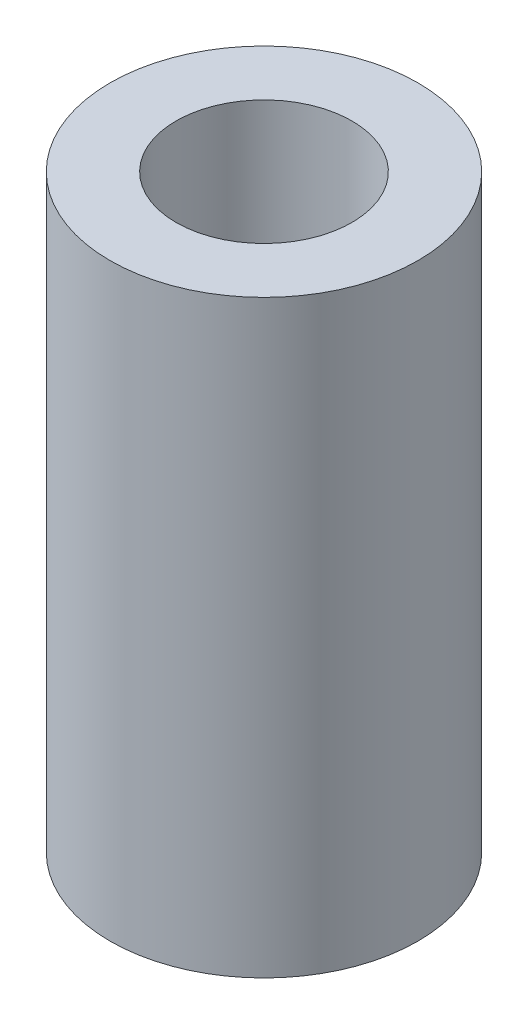
from build123d import *

# Parameters (mm, degrees)
SKETCH1_R           = 1.75
SKETCH1_R_2         = 1
BOSS_EXTRUDE1_DEPTH = 6.7


with BuildPart() as part:
    # Sketch1 → Boss-Extrude1 (new body)
    with BuildSketch(Plane(origin=(0, 0, 0), x_dir=(1, 0, 0), z_dir=(0, 1, 0))):
        with Locations(Location((0, 0, 0), (0, 0, 270))):
            Circle(SKETCH1_R)
        with Locations(Location((0, 0, 0), (0, 0, 270))):
            Circle(SKETCH1_R_2, mode=Mode.SUBTRACT)
    extrude(amount=BOSS_EXTRUDE1_DEPTH)


solid = part.part
